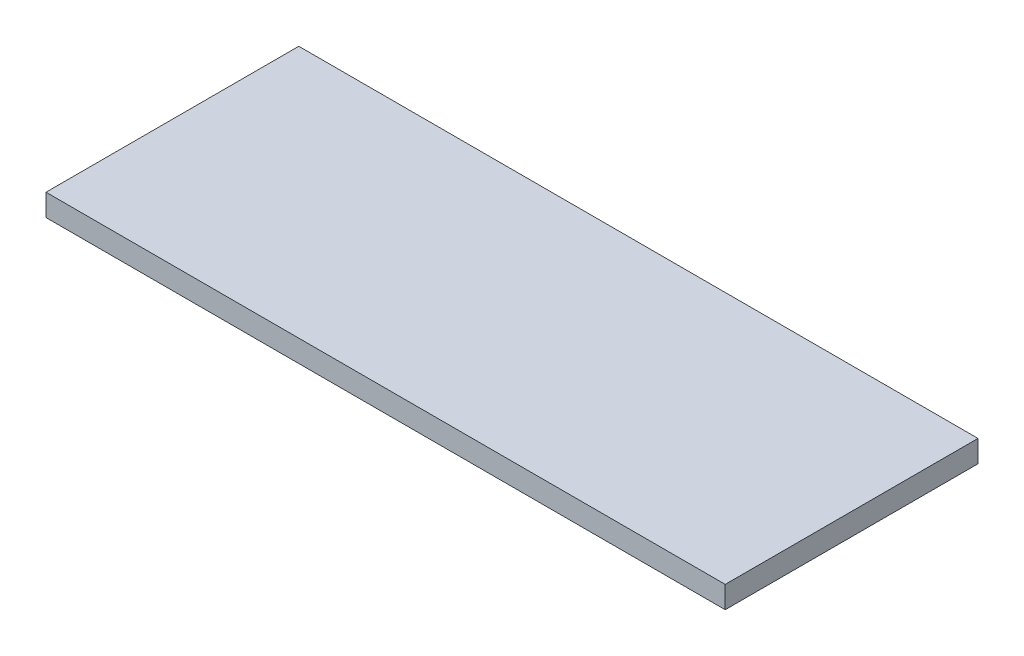
from build123d import *

# Parameters (mm, degrees)
SKETCH1_W           = 309
SKETCH1_H           = 115
BOSS_EXTRUDE1_DEPTH = 10


with BuildPart() as part:
    # Sketch1 → Boss-Extrude1 (new body)
    with BuildSketch(Plane(origin=(0, 0, 0), x_dir=(1, 0, 0), z_dir=(0, 1, 0))):
        with Locations((154.5, 57.5)):
            Rectangle(SKETCH1_W, SKETCH1_H)
    extrude(amount=BOSS_EXTRUDE1_DEPTH)


solid = part.part
